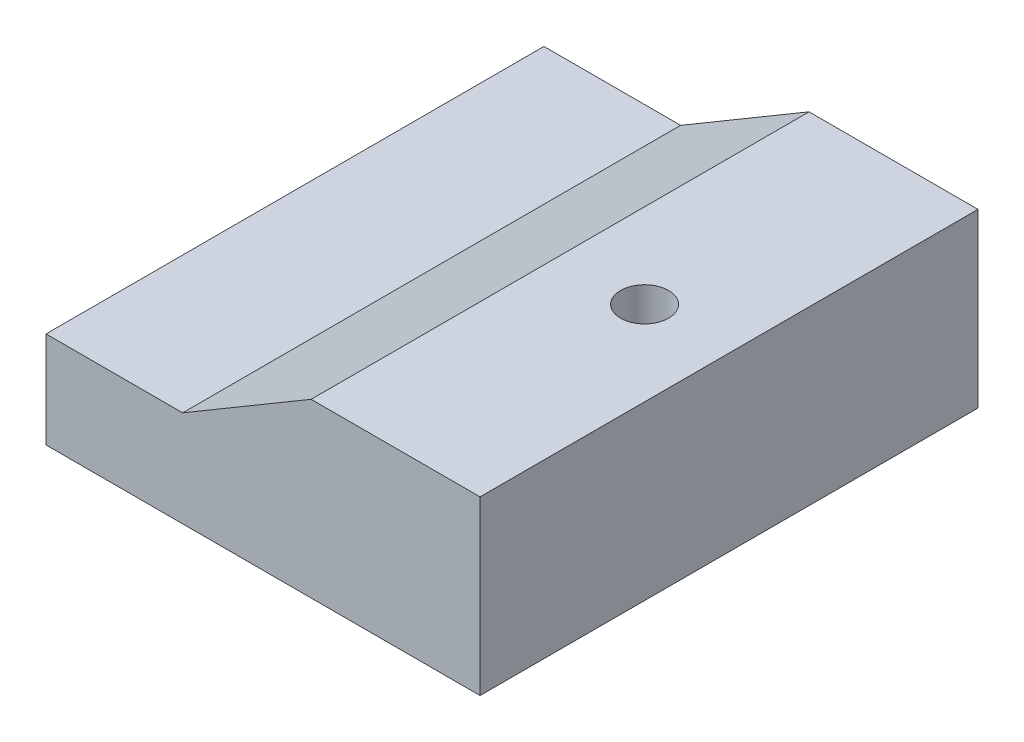
from build123d import *

# Parameters (mm, degrees)
BOSS_EXTRUDE1_DEPTH = 7870
SKETCH2_R           = 380
CUT_EXTRUDE1_DEPTH  = 10789.646810421


with BuildPart() as part:
    # Sketch1 → Boss-Extrude1 (new body)
    with BuildSketch(Plane.XY):
        Polygon((0, 0), (-6860, 0), (-6860, 1520), (-4700, 1520), (-2670, 2720), (0, 2720), align=None)
    extrude(amount=BOSS_EXTRUDE1_DEPTH)

    # Sketch2 → Cut-Extrude1 (cut, through all)
    with BuildSketch(Plane(origin=(0, 2720, 0), x_dir=(1, 0, 0), z_dir=(0, 1, 0))):
        with Locations(Location((-1335, -3935, 0), (0, 0, 270))):
            Circle(SKETCH2_R)
    extrude(amount=-CUT_EXTRUDE1_DEPTH, mode=Mode.SUBTRACT)


solid = part.part
